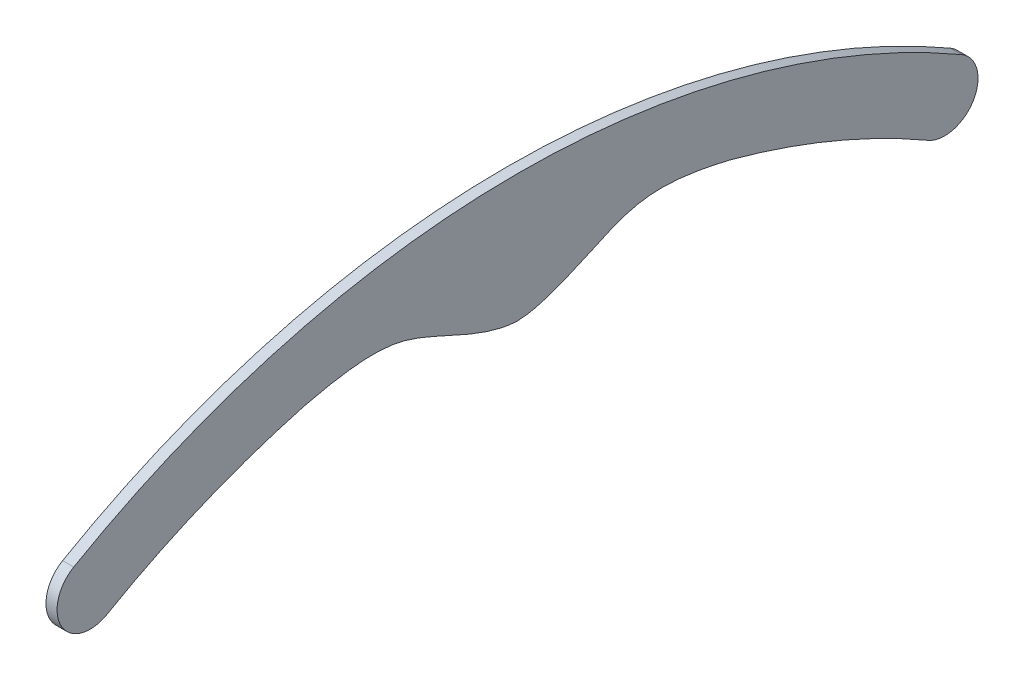
from build123d import *

# Parameters (mm, degrees)
RESSALTO_EXTRUS_O1_DEPTH = 2.5


with BuildPart() as part:
    # Esboço1 → Ressalto-extrusão1 (new body)
    with BuildSketch(Plane.YZ):
        with BuildLine():
            ThreePointArc((350.755952356, -100), (377.550871599, 0), (350.755952356, 100))
            ThreePointArc((350.755952356, 100), (340.510761827, 102.745190528), (337.765571299, 92.5))
            ThreePointArc((337.765571299, 92.5), (348.462298659, 70.811609925), (356.238644162, 47.913254287))
            add(Edge.make_bspline(
                [(356.238644162, 47.913254287), (360.34603799, 30.905478266), (357.108936786, 22.632743478), (348.864388441, 5.278932836), (348.785718872, 0)],
                knots=[0.097242939, 0.097242939, 0.097242939, 0.097242939, 0.646678025, 1, 1, 1, 1], degree=3))
            add(Edge.make_bspline(
                [(356.238644162, -47.913254287), (360.34603799, -30.905478266), (357.108936786, -22.632743478), (348.864388441, -5.278932836), (348.785718872, 0)],
                knots=[0.097242939, 0.097242939, 0.097242939, 0.097242939, 0.646678025, 1, 1, 1, 1], degree=3))
            ThreePointArc((356.238644162, -47.913254287), (348.462298659, -70.811609925), (337.765571299, -92.5))
            ThreePointArc((337.765571299, -92.5), (340.510761827, -102.745190528), (350.755952356, -100))
        make_face()
    extrude(amount=RESSALTO_EXTRUS_O1_DEPTH)


solid = part.part
